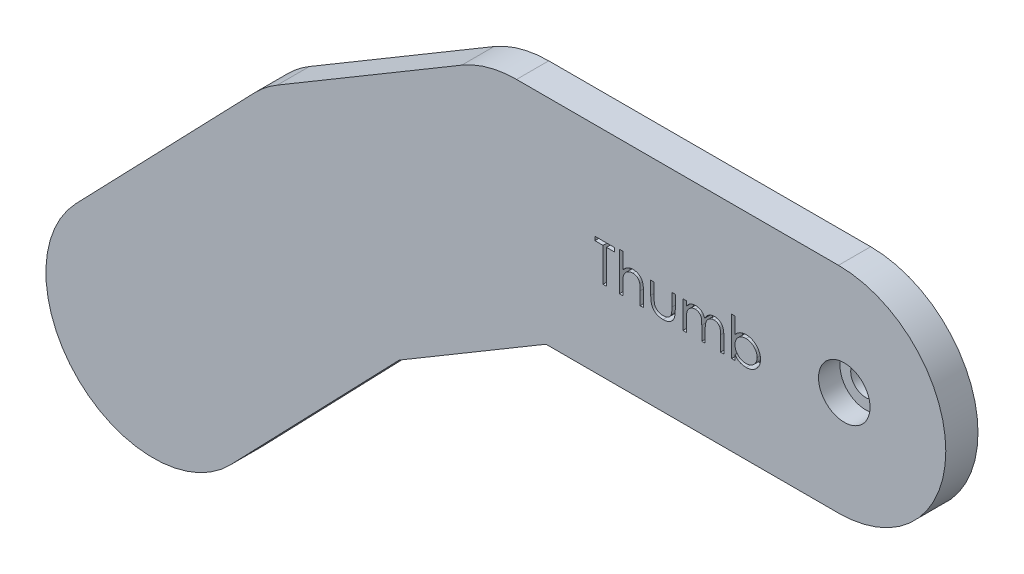
from build123d import *

# Parameters (mm, degrees)
BOSS_EXTRUDE1_DEPTH = 3
BOSS_EXTRUDE2_DEPTH = 3
BOSS_EXTRUDE4_DEPTH = 3
SKETCH4_R           = 1.4
CUT_EXTRUDE5_DEPTH  = 3
SKETCH5_R           = 2.4
CUT_EXTRUDE6_DEPTH  = 2
CUT_EXTRUDE7_DEPTH  = 1


with BuildPart() as part:
    # Sketch1 → Boss-Extrude1 (new body)
    with BuildSketch(Plane.XY):
        with BuildLine():
            Line((0, 10), (30, 10))
            ThreePointArc((30, 10), (40, 0), (30, -10))
            Line((30, -10), (0, -10))
            ThreePointArc((0, -10), (-10, 0), (0, 10))
        make_face()
    extrude(amount=BOSS_EXTRUDE1_DEPTH)

    # Sketch2 → Boss-Extrude2 (add)
    with BuildSketch(Plane.XY):
        with BuildLine():
            Line((5.104260767, -8.599216361), (-12.094171954, -18.807737895))
            ThreePointArc((-12.094171954, -18.807737895), (-25.797649082, -15.312782302), (-22.302693489, -1.609305174))
            Line((-22.302693489, -1.609305174), (-5.104260767, 8.599216361))
            ThreePointArc((-5.104260767, 8.599216361), (8.599216361, 5.104260767), (5.104260767, -8.599216361))
        make_face()
    extrude(amount=BOSS_EXTRUDE2_DEPTH)

    # Sketch3 → Boss-Extrude4 (add)
    with BuildSketch(Plane.XY):
        with BuildLine():
            Line((-9.998884105, -17.148730445), (-26.65538549, -34.427647124))
            ThreePointArc((-26.65538549, -34.427647124), (-40.795143017, -34.68698683), (-41.054482723, -20.547229303))
            Line((-41.054482723, -20.547229303), (-24.397981338, -3.268312624))
            ThreePointArc((-24.397981338, -3.268312624), (-10.258223811, -3.008972918), (-9.998884105, -17.148730445))
        make_face()
    extrude(amount=BOSS_EXTRUDE4_DEPTH)

    # Sketch4 → Cut-Extrude5 (cut)
    with BuildSketch(Plane.XY):
        with Locations((30.538598823, 0)):
            Circle(SKETCH4_R)
    extrude(amount=CUT_EXTRUDE5_DEPTH, mode=Mode.SUBTRACT)

    # Sketch5 → Cut-Extrude6 (cut)
    with BuildSketch(Plane.XY.offset(3)):
        with Locations((30.538598823, 0)):
            Circle(SKETCH5_R)
    extrude(amount=-CUT_EXTRUDE6_DEPTH, mode=Mode.SUBTRACT)

    # Sketch6 → Cut-Extrude7 (cut)
    # profile 1 of 5: a face of its own
    with BuildSketch(Plane.XY.offset(3)):
        Polygon((7.297191398, 0.636947758), (7.297191398, 0.995922117), (9.136934988, 0.995922117), (9.136934988, 0.636947758), (8.374114475, 0.636947758), (8.374114475, -2.504077883), (8.060011911, -2.504077883), (8.060011911, 0.636947758), align=None)
    # profile 2 of 5: a face of its own
    with BuildSketch(Plane.XY.offset(3)):
        with BuildLine():
            Line((9.585652937, 1.085665707), (9.899755501, 1.085665707))
            Line((9.899755501, 1.085665707), (9.899755501, -0.429458492))
            add(Edge.make_bspline(
                [(9.899755501, -0.429458492), (9.933472803, -0.38731451), (9.999122117, -0.305258017), (10.109618233, -0.198196826), (10.223089105, -0.105398205), (10.343453915, -0.031527748), (10.468504436, 0.026828795), (10.59876808, 0.068216442), (10.734269051, 0.093667538), (10.826294201, 0.096865956), (10.872912552, 0.098486219)],
                knots=[0, 0, 0, 0, 1.125788106, 2.19196713, 3.20547328, 4.180437432, 5.132270164, 6.079753143, 7.027236121, 8, 8, 8, 8], degree=3))
            add(Edge.make_bspline(
                [(10.872912552, 0.098486219), (10.920242945, 0.096740789), (11.012879941, 0.093324561), (11.147761403, 0.06631118), (11.273722278, 0.020153742), (11.390388121, -0.043013283), (11.495212818, -0.12168611), (11.588062582, -0.212517633), (11.663903381, -0.317791551), (11.715502498, -0.415047805), (11.749075906, -0.501586559), (11.770327732, -0.575823071), (11.788346931, -0.658544984), (11.804046666, -0.749709717), (11.814510248, -0.849754888), (11.822914866, -0.958229143), (11.82889132, -1.075126261), (11.829122925, -1.15604651), (11.82924268, -1.197887979)],
                knots=[0, 0, 0, 0, 1.235656852, 2.418478516, 3.575258207, 4.727955599, 5.870717718, 6.98870536, 8.107142894, 9.245821548, 9.854588956, 10.528768408, 11.260415777, 12.065282286, 12.943670737, 13.886611085, 14.907229059, 16, 16, 16, 16], degree=3))
            Line((11.82924268, -1.197887979), (11.82924268, -2.504077883))
            Line((11.82924268, -2.504077883), (11.515140116, -2.504077883))
            Line((11.515140116, -2.504077883), (11.515140116, -1.300952883))
            add(Edge.make_bspline(
                [(11.515140116, -1.300952883), (11.514949813, -1.266130214), (11.514585796, -1.199520373), (11.513382451, -1.104154265), (11.510696236, -1.01765813), (11.50635541, -0.940309178), (11.501790103, -0.871999575), (11.495506785, -0.812828521), (11.488196551, -0.762714745), (11.48162777, -0.732550117), (11.478681783, -0.719021793)],
                knots=[0, 0, 0, 0, 1.430932559, 2.737130458, 3.918967929, 4.986496826, 5.920444988, 6.731744033, 7.431208747, 8, 8, 8, 8], degree=3))
            add(Edge.make_bspline(
                [(11.478681783, -0.719021793), (11.467257538, -0.67932753), (11.445294493, -0.603015539), (11.394246516, -0.499353129), (11.330487505, -0.410968388), (11.252640243, -0.3390541), (11.162081879, -0.282642561), (11.058221915, -0.243574779), (10.942037847, -0.219327057), (10.860186375, -0.216887753), (10.81752393, -0.215616345)],
                knots=[0, 0, 0, 0, 1.090059168, 2.095632401, 3.037101401, 3.955032261, 4.878929692, 5.839099886, 6.873700383, 8, 8, 8, 8], degree=3))
            add(Edge.make_bspline(
                [(10.81752393, -0.215616345), (10.792256157, -0.216092171), (10.742251887, -0.217033819), (10.668103221, -0.226487718), (10.596174158, -0.241936436), (10.52577198, -0.262840975), (10.458388782, -0.291286511), (10.392060457, -0.324216701), (10.328666248, -0.364524956), (10.267080431, -0.409750723), (10.209762898, -0.459820483), (10.156435783, -0.512667438), (10.108897442, -0.568942402), (10.065828851, -0.627742518), (10.028650566, -0.689874312), (9.996197484, -0.75473863), (9.968661787, -0.822420776), (9.954979095, -0.869395837), (9.948132905, -0.892899999)],
                knots=[0, 0, 0, 0, 1.024319606, 2.027102035, 3.025350316, 4.005802111, 5.00026367, 5.987881639, 7.005602596, 8.042517216, 9.083927026, 10.089214625, 11.084353441, 12.06828073, 13.041928858, 14.016821737, 15.00770877, 16, 16, 16, 16], degree=3))
            add(Edge.make_bspline(
                [(9.948132905, -0.892899999), (9.944193478, -0.909920949), (9.935608981, -0.947011696), (9.926294147, -1.00818602), (9.917956351, -1.079272392), (9.910907801, -1.160162993), (9.906584715, -1.251154235), (9.901926474, -1.351625194), (9.90019246, -1.462205215), (9.899905507, -1.539100722), (9.899755501, -1.579298236)],
                knots=[0, 0, 0, 0, 0.607992626, 1.324890765, 2.152360218, 3.099583803, 4.150613268, 5.323148443, 6.60066238, 8, 8, 8, 8], degree=3))
            Line((9.899755501, -1.579298236), (9.899755501, -2.504077883))
            Line((9.899755501, -2.504077883), (9.585652937, -2.504077883))
            Line((9.585652937, -2.504077883), (9.585652937, 1.085665707))
        make_face()
    # profile 3 of 5: a face of its own
    with BuildSketch(Plane.XY.offset(3)):
        with BuildLine():
            Line((12.502319604, 0.053614425), (12.816422168, 0.053614425))
            Line((12.816422168, 0.053614425), (12.816422168, -1.132683652))
            add(Edge.make_bspline(
                [(12.816422168, -1.132683652), (12.816564073, -1.167506402), (12.81683553, -1.23412069), (12.818676471, -1.329975876), (12.823006565, -1.417392589), (12.828420389, -1.496421326), (12.835382525, -1.567048717), (12.843665886, -1.629028074), (12.852924307, -1.683062258), (12.861987021, -1.715605614), (12.866201815, -1.730740543)],
                knots=[0, 0, 0, 0, 1.388932606, 2.656963016, 3.823490214, 4.879454478, 5.816252168, 6.653371382, 7.373723809, 8, 8, 8, 8], degree=3))
            add(Edge.make_bspline(
                [(12.866201815, -1.730740543), (12.87296327, -1.749763414), (12.886345611, -1.787413675), (12.910619095, -1.841802681), (12.940647431, -1.892177963), (12.973507259, -1.940482036), (13.011406667, -1.985284023), (13.053866138, -2.026508266), (13.099464375, -2.065712358), (13.167219398, -2.11209715), (13.259878664, -2.16181248), (13.38153142, -2.204708298), (13.513435646, -2.230344118), (13.604600365, -2.233318373), (13.651458225, -2.234847114)],
                knots=[0, 0, 0, 0, 0.725840625, 1.436591201, 2.137033971, 2.831655856, 3.53531722, 4.242432219, 4.957935707, 5.694543706, 7.190802206, 8.724350549, 10.316345118, 12, 12, 12, 12], degree=3))
            add(Edge.make_bspline(
                [(13.651458225, -2.234847114), (13.698311733, -2.233285865), (13.788964601, -2.230265138), (13.919419571, -2.2054816), (14.038670985, -2.16407591), (14.145521936, -2.106268499), (14.239487777, -2.035526436), (14.317792195, -1.952517627), (14.38239945, -1.85986824), (14.41060887, -1.790743961), (14.424795565, -1.755980928)],
                knots=[0, 0, 0, 0, 1.157059328, 2.238695713, 3.266970494, 4.264342957, 5.228770407, 6.160125903, 7.074715775, 8, 8, 8, 8], degree=3))
            add(Edge.make_bspline(
                [(14.424795565, -1.755980928), (14.428989795, -1.742014629), (14.438262213, -1.711138554), (14.448224565, -1.658758806), (14.457199027, -1.596294201), (14.464862203, -1.523335992), (14.470327365, -1.44007484), (14.473273392, -1.346536764), (14.476601667, -1.243015404), (14.476652183, -1.170547644), (14.476678578, -1.132683652)],
                knots=[0, 0, 0, 0, 0.557542046, 1.232589297, 2.036731608, 2.971723315, 4.038036528, 5.22795436, 6.551621927, 8, 8, 8, 8], degree=3))
            Line((14.476678578, -1.132683652), (14.476678578, 0.053614425))
            Line((14.476678578, 0.053614425), (14.790781142, 0.053614425))
            Line((14.790781142, 0.053614425), (14.790781142, -1.191577883))
            add(Edge.make_bspline(
                [(14.790781142, -1.191577883), (14.790339447, -1.233885055), (14.789482499, -1.315966754), (14.783975155, -1.435250866), (14.774525543, -1.546413111), (14.760182858, -1.649512331), (14.743317183, -1.744469812), (14.72156091, -1.831407258), (14.695582672, -1.910056812), (14.666277157, -1.981798589), (14.63165529, -2.046845483), (14.594828269, -2.1085813), (14.552303498, -2.165474235), (14.507533263, -2.220356372), (14.457731607, -2.2704979), (14.403831748, -2.317049376), (14.346592329, -2.360722407), (14.284743131, -2.399813687), (14.219187068, -2.435030332), (14.149843211, -2.46624641), (14.075862212, -2.490948987), (13.998198575, -2.512259653), (13.916471796, -2.528974122), (13.830760663, -2.540760689), (13.741094047, -2.54798602), (13.679984587, -2.548623065), (13.648653738, -2.548949678)],
                knots=[0, 0, 0, 0, 1.493040784, 2.896703357, 4.213163133, 5.428574705, 6.569057535, 7.615249723, 8.588095153, 9.490268104, 10.346124644, 11.18633936, 12.024365274, 12.850166724, 13.684164916, 14.514361689, 15.362232829, 16.222528818, 17.093394965, 17.986930858, 18.902426812, 19.842810585, 20.827885679, 21.843828298, 22.894529745, 24, 24, 24, 24], degree=3))
            add(Edge.make_bspline(
                [(13.648653738, -2.548949678), (13.617557224, -2.548609971), (13.556449679, -2.547942415), (13.466778435, -2.540800607), (13.380829828, -2.528992436), (13.29890943, -2.512137219), (13.220935033, -2.491098149), (13.146590793, -2.466094614), (13.07674723, -2.435014132), (13.010565226, -2.400036574), (12.948562838, -2.360471299), (12.890454259, -2.317103259), (12.836317407, -2.269997196), (12.786140339, -2.219349839), (12.740627362, -2.164532903), (12.699211321, -2.105987342), (12.661254615, -2.044293254), (12.626901825, -1.978230091), (12.59739007, -1.905658082), (12.571334824, -1.825360984), (12.550024185, -1.736458468), (12.532681717, -1.639026539), (12.518730276, -1.533531498), (12.509044134, -1.419363082), (12.503628303, -1.29679939), (12.502765242, -1.2121495), (12.502319604, -1.168440864)],
                knots=[0, 0, 0, 0, 1.083640291, 2.129454052, 3.13281866, 4.105697902, 5.042300162, 5.946461698, 6.836384745, 7.703652036, 8.553297018, 9.397182691, 10.228592656, 11.052265423, 11.879314572, 12.708807002, 13.549817954, 14.402308542, 15.300838682, 16.27712199, 17.341985831, 18.484375296, 19.725102775, 21.0496083, 22.476576903, 24, 24, 24, 24], degree=3))
            Line((12.502319604, -1.168440864), (12.502319604, 0.053614425))
        make_face()
    # profile 4 of 5: a face of its own
    with BuildSketch(Plane.XY.offset(3)):
        with BuildLine():
            Line((15.50872986, 0.053614425), (15.822832424, 0.053614425))
            Line((15.822832424, 0.053614425), (15.822832424, -0.390896793))
            add(Edge.make_bspline(
                [(15.822832424, -0.390896793), (15.851116374, -0.352009192), (15.905311134, -0.277496819), (15.994176786, -0.179306534), (16.082952899, -0.09597838), (16.14688628, -0.052235508), (16.177600052, -0.031221313)],
                knots=[0, 0, 0, 0, 1.134379233, 2.173579362, 3.122582517, 4, 4, 4, 4], degree=3))
            add(Edge.make_bspline(
                [(16.177600052, -0.031221313), (16.219464714, -0.011215947), (16.302462614, 0.028445266), (16.433881839, 0.068678825), (16.568356509, 0.093403926), (16.659164723, 0.0967853), (16.704843642, 0.098486219)],
                knots=[0, 0, 0, 0, 1.014936303, 2.012140481, 3.000054389, 4, 4, 4, 4], degree=3))
            add(Edge.make_bspline(
                [(16.704843642, 0.098486219), (16.735736639, 0.097440929), (16.796872218, 0.095372354), (16.887456308, 0.081912319), (16.97531492, 0.058646146), (17.059928949, 0.026238822), (17.139649628, -0.013007865), (17.212738826, -0.059057573), (17.278363034, -0.110754648), (17.336489085, -0.170433581), (17.388758111, -0.239770179), (17.436836957, -0.320634428), (17.48126217, -0.414842089), (17.505883479, -0.48320863), (17.518846046, -0.519202082)],
                knots=[0, 0, 0, 0, 1.009824226, 1.998387844, 2.986035974, 3.974953746, 4.955485308, 5.885931332, 6.793869504, 7.679848016, 8.601185859, 9.625726857, 10.749998409, 12, 12, 12, 12], degree=3))
            add(Edge.make_bspline(
                [(17.518846046, -0.519202082), (17.532557297, -0.494477663), (17.559539114, -0.445823478), (17.604844751, -0.376965215), (17.652312548, -0.312558424), (17.702347041, -0.252551999), (17.754771628, -0.197242269), (17.809833028, -0.146446367), (17.86721781, -0.099946153), (17.947010049, -0.045622994), (18.050822657, 0.012078187), (18.181710772, 0.062106631), (18.317860943, 0.09302276), (18.410278641, 0.096653033), (18.456947007, 0.098486219)],
                knots=[0, 0, 0, 0, 0.86119277, 1.694706429, 2.50939023, 3.298075842, 4.073795165, 4.829715201, 5.57930267, 6.321991688, 7.768977793, 9.186738141, 10.579381044, 12, 12, 12, 12], degree=3))
            add(Edge.make_bspline(
                [(18.456947007, 0.098486219), (18.49982847, 0.096868999), (18.583751656, 0.09370394), (18.705928922, 0.068850467), (18.819870728, 0.02617282), (18.925347804, -0.032060817), (19.020507617, -0.10524), (19.103223926, -0.192308838), (19.17299429, -0.292651461), (19.218572929, -0.387043449), (19.249488193, -0.470378782), (19.268549428, -0.541385073), (19.285389123, -0.619536626), (19.299370368, -0.704926888), (19.30958892, -0.797857496), (19.317159636, -0.898176372), (19.322283709, -1.005961484), (19.322645782, -1.080326984), (19.322832424, -1.118661216)],
                knots=[0, 0, 0, 0, 1.209669288, 2.367440248, 3.500751976, 4.631527125, 5.755587489, 6.87532382, 8.007944318, 9.190864318, 9.82315674, 10.514484317, 11.263564316, 12.079023757, 12.955305781, 13.901327259, 14.918167583, 16, 16, 16, 16], degree=3))
            Line((19.322832424, -1.118661216), (19.322832424, -2.504077883))
            Line((19.322832424, -2.504077883), (19.00872986, -2.504077883))
            Line((19.00872986, -2.504077883), (19.00872986, -1.117258973))
            add(Edge.make_bspline(
                [(19.00872986, -1.117258973), (19.008651977, -1.084538399), (19.008502298, -1.021654432), (19.005808666, -0.931401981), (19.000733352, -0.849133624), (18.994798713, -0.774961535), (18.986554904, -0.708712747), (18.975908972, -0.650520328), (18.964631292, -0.599926517), (18.945895301, -0.543840469), (18.91594741, -0.481970259), (18.87032993, -0.415246683), (18.812859823, -0.357165883), (18.746499667, -0.306747566), (18.670951222, -0.265753925), (18.587686499, -0.236477915), (18.497222447, -0.218355037), (18.434599659, -0.216549021), (18.402259507, -0.215616345)],
                knots=[0, 0, 0, 0, 1.253487763, 2.409012846, 3.458416907, 4.410876679, 5.259312806, 6.014470957, 6.676830364, 7.243083969, 8.276244668, 9.299465089, 10.325150304, 11.392391894, 12.482080715, 13.603491619, 14.762376348, 16, 16, 16, 16], degree=3))
            add(Edge.make_bspline(
                [(18.402259507, -0.215616345), (18.362589553, -0.217032502), (18.284186642, -0.219831367), (18.169741156, -0.24840524), (18.059770139, -0.291485491), (17.957555006, -0.353917948), (17.863527215, -0.428726312), (17.782627638, -0.517675908), (17.715795452, -0.618305835), (17.670541476, -0.711452537), (17.641952175, -0.795121981), (17.623075259, -0.868219353), (17.608391868, -0.951300921), (17.594621338, -1.043808412), (17.58563361, -1.146378592), (17.577465238, -1.258536993), (17.573644375, -1.380620952), (17.573109917, -1.465247641), (17.572832424, -1.509186056)],
                knots=[0, 0, 0, 0, 1.090531906, 2.155305635, 3.229839962, 4.33261226, 5.44038871, 6.529323825, 7.629011124, 8.757537029, 9.370236727, 10.061839251, 10.834451254, 11.692844982, 12.636905849, 13.66920014, 14.789842145, 16, 16, 16, 16], degree=3))
            Line((17.572832424, -1.509186056), (17.572832424, -2.504077883))
            Line((17.572832424, -2.504077883), (17.25872986, -2.504077883))
            Line((17.25872986, -2.504077883), (17.25872986, -1.203496954))
            add(Edge.make_bspline(
                [(17.25872986, -1.203496954), (17.258650429, -1.166803635), (17.258497612, -1.096209378), (17.255821294, -0.994975702), (17.250734673, -0.902894622), (17.244854124, -0.820073158), (17.236393946, -0.74666183), (17.226784184, -0.682267072), (17.215435573, -0.627050321), (17.196645689, -0.566486936), (17.16793122, -0.499766013), (17.121742958, -0.428624992), (17.064135378, -0.366356894), (16.996564502, -0.313198146), (16.92055882, -0.269256664), (16.836575419, -0.237596913), (16.745370506, -0.219172623), (16.6824928, -0.216824126), (16.650156142, -0.215616345)],
                knots=[0, 0, 0, 0, 1.320475261, 2.540461679, 3.643808994, 4.639130445, 5.527981419, 6.302341397, 6.981980563, 7.553956391, 8.582137848, 9.585246428, 10.591171744, 11.620968678, 12.668337649, 13.738356861, 14.836885341, 16, 16, 16, 16], degree=3))
            add(Edge.make_bspline(
                [(16.650156142, -0.215616345), (16.612139931, -0.217146805), (16.536374971, -0.220196957), (16.425073001, -0.247651231), (16.317587318, -0.290655306), (16.215632619, -0.350315125), (16.121958471, -0.424214203), (16.039950203, -0.511129099), (15.971007678, -0.609978133), (15.925275863, -0.702142649), (15.895777389, -0.783715924), (15.876182054, -0.853066872), (15.859342428, -0.93006712), (15.846828407, -1.014954231), (15.834747991, -1.107175325), (15.828917682, -1.207189815), (15.82324612, -1.314911903), (15.822973705, -1.389284448), (15.822832424, -1.427855928)],
                knots=[0, 0, 0, 0, 1.098833095, 2.189935336, 3.297829714, 4.440610912, 5.596351641, 6.740013378, 7.886572111, 9.072425424, 9.705826452, 10.395263256, 11.156850408, 11.985370555, 12.878090359, 13.847760091, 14.883794034, 16, 16, 16, 16], degree=3))
            Line((15.822832424, -1.427855928), (15.822832424, -2.504077883))
            Line((15.822832424, -2.504077883), (15.50872986, -2.504077883))
            Line((15.50872986, -2.504077883), (15.50872986, 0.053614425))
        make_face()
    # profile 5 of 5: a face of its own
    with BuildSketch(Plane.XY.offset(3)):
        with BuildLine():
            Line((20.040781142, -2.504077883), (20.040781142, 1.085665707))
            Line((20.040781142, 1.085665707), (20.354883706, 1.085665707))
            Line((20.354883706, 1.085665707), (20.354883706, -0.410528204))
            add(Edge.make_bspline(
                [(20.354883706, -0.410528204), (20.390277125, -0.369770272), (20.459331145, -0.290249867), (20.575107596, -0.186402217), (20.696513165, -0.098349739), (20.824471421, -0.025763621), (20.959164354, 0.029509986), (21.099896463, 0.069932376), (21.247027504, 0.094319279), (21.347346678, 0.097085352), (21.398152937, 0.098486219)],
                knots=[0, 0, 0, 0, 1.077089805, 2.101446609, 3.097517232, 4.067117542, 5.031729543, 5.997785507, 6.985986182, 8, 8, 8, 8], degree=3))
            add(Edge.make_bspline(
                [(21.398152937, 0.098486219), (21.443319075, 0.097245991), (21.532620227, 0.094793849), (21.663902374, 0.076159353), (21.790215649, 0.045941551), (21.911491297, 0.004049372), (22.027163429, -0.051533605), (22.138222486, -0.118074913), (22.244099471, -0.197313242), (22.343154356, -0.287911553), (22.434448243, -0.386268176), (22.514360753, -0.491448491), (22.581860449, -0.601923581), (22.637691741, -0.717323644), (22.680862794, -0.838119995), (22.710605062, -0.964194193), (22.729498526, -1.095422212), (22.731878772, -1.184735016), (22.733088834, -1.230139582)],
                knots=[0, 0, 0, 0, 1.034377878, 2.045141349, 3.03070803, 4.00595497, 4.978199603, 5.965204761, 6.967410914, 8.002051993, 9.036360596, 10.037508045, 11.022711142, 11.997267194, 12.969246472, 13.954813154, 14.960274251, 16, 16, 16, 16], degree=3))
            add(Edge.make_bspline(
                [(22.733088834, -1.230139582), (22.731852394, -1.2748396), (22.729414328, -1.362980995), (22.71079302, -1.492687551), (22.680046755, -1.61752625), (22.636085572, -1.737174508), (22.580820633, -1.852194421), (22.511709357, -1.961274825), (22.431898358, -2.066313801), (22.339567209, -2.163937432), (22.239653656, -2.254170832), (22.132739414, -2.332576697), (22.021517492, -2.400293817), (21.90425438, -2.453949265), (21.782686338, -2.497350186), (21.655510951, -2.527467877), (21.523447723, -2.545040932), (21.433728835, -2.547636499), (21.388337232, -2.548949678)],
                knots=[0, 0, 0, 0, 1.024244038, 2.01964794, 2.996620209, 3.965911562, 4.936179293, 5.91563013, 6.920572822, 7.955171681, 8.990768464, 10.002129126, 10.989675881, 11.969873457, 12.952483066, 13.943799762, 14.959703725, 16, 16, 16, 16], degree=3))
            add(Edge.make_bspline(
                [(21.388337232, -2.548949678), (21.336372119, -2.54750907), (21.234477595, -2.544684288), (21.08542493, -2.521265309), (20.94434338, -2.481403699), (20.809625832, -2.427841943), (20.683198109, -2.355313289), (20.564257527, -2.265356539), (20.453554154, -2.156489402), (20.388337339, -2.073427912), (20.354883706, -2.030820672)],
                knots=[0, 0, 0, 0, 1.035807596, 2.031038093, 2.998900396, 3.954262848, 4.914341711, 5.895762244, 6.92060972, 8, 8, 8, 8], degree=3))
            Line((20.354883706, -2.030820672), (20.354883706, -2.504077883))
            Line((20.354883706, -2.504077883), (20.040781142, -2.504077883))
        make_face()
        with BuildLine():
            add(Edge.make_bspline(
                [(21.385532745, -2.234847114), (21.431447097, -2.233213485), (21.522074726, -2.229988961), (21.655118516, -2.204815338), (21.782432726, -2.162931224), (21.903375808, -2.105647516), (22.01605512, -2.033625481), (22.116707754, -1.946479311), (22.206187464, -1.846977796), (22.28083924, -1.734744103), (22.343165484, -1.615293134), (22.38597876, -1.489638832), (22.414698482, -1.361144043), (22.41755078, -1.273997999), (22.41898627, -1.230139582)],
                knots=[0, 0, 0, 0, 1.031910345, 2.036826888, 3.032245421, 4.038315463, 5.03827337, 6.029480047, 7.023177075, 8.037597977, 9.052889626, 10.043399556, 11.015292101, 12, 12, 12, 12], degree=3))
            add(Edge.make_bspline(
                [(22.41898627, -1.230139582), (22.417098526, -1.18632404), (22.413330575, -1.098867879), (22.386955792, -0.969218212), (22.340898002, -0.843630587), (22.279779979, -0.722452599), (22.203911994, -0.609444798), (22.11490603, -0.507954671), (22.013024224, -0.420394687), (21.900200805, -0.347404616), (21.780020614, -0.287845063), (21.653529981, -0.247000037), (21.523371858, -0.22026185), (21.434976365, -0.217172722), (21.390440597, -0.215616345)],
                knots=[0, 0, 0, 0, 0.984795267, 1.965658976, 2.959410029, 3.983795688, 5.009594896, 6.01088574, 7.009236619, 8.019050059, 9.024672985, 10.014834719, 10.999826153, 12, 12, 12, 12], degree=3))
            add(Edge.make_bspline(
                [(21.390440597, -0.215616345), (21.34497309, -0.217171842), (21.254729313, -0.220259189), (21.121561091, -0.247047013), (20.991497807, -0.288094624), (20.867210275, -0.347025974), (20.75135622, -0.419137434), (20.647743608, -0.503877634), (20.55841205, -0.600657542), (20.484868279, -0.709163344), (20.42646348, -0.826348379), (20.384679732, -0.951360582), (20.359680086, -1.083541895), (20.356501953, -1.1741751), (20.354883706, -1.220323877)],
                knots=[0, 0, 0, 0, 1.016820015, 2.018181405, 3.029022337, 4.06341356, 5.088169224, 6.076823655, 7.05054209, 8.02560866, 9.001194327, 9.972267242, 10.967515442, 12, 12, 12, 12], degree=3))
            add(Edge.make_bspline(
                [(20.354883706, -1.220323877), (20.355843377, -1.255661695), (20.357732312, -1.325217705), (20.37216268, -1.427345395), (20.395118342, -1.525078488), (20.427461836, -1.618523483), (20.469963071, -1.707149923), (20.521173336, -1.791646003), (20.582124983, -1.871249281), (20.651031572, -1.945764601), (20.726993953, -2.013574016), (20.808517072, -2.072352241), (20.893935002, -2.122966431), (20.984224973, -2.163311274), (21.078336264, -2.196237794), (21.177234605, -2.21797154), (21.279906029, -2.232946579), (21.349953126, -2.234206932), (21.385532745, -2.234847114)],
                knots=[0, 0, 0, 0, 1.050331198, 2.067384183, 3.060053655, 4.031335885, 5.001026174, 5.976994447, 6.963687968, 7.976578778, 8.990422448, 9.985569286, 10.960374351, 11.936812464, 12.921228065, 13.919088064, 14.943024695, 16, 16, 16, 16], degree=3))
        make_face(mode=Mode.SUBTRACT)
    extrude(amount=-CUT_EXTRUDE7_DEPTH, mode=Mode.SUBTRACT)


solid = part.part
